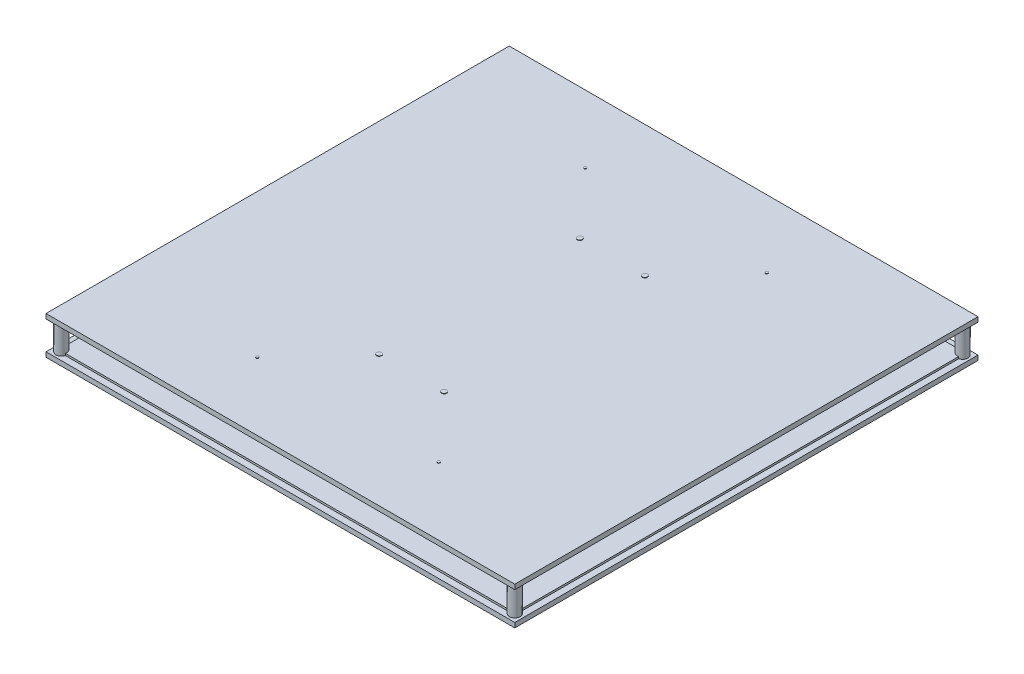
from build123d import *

# Parameters (mm, degrees)
SKETCH1_W           = 310.792155558
SKETCH1_H           = 307.10414309
BOSS_EXTRUDE1_DEPTH = 3.175
SKETCH2_W           = 302.308555558
SKETCH2_H           = 298.62054309
BOSS_EXTRUDE2_DEPTH = 1.27
BOSS_EXTRUDE4_DEPTH = 3.175
SKETCH6_R           = 0.911045746
SKETCH6_R_2         = 1.683740392
BOSS_EXTRUDE7_DEPTH = 0.254
SKETCH7_R           = 3.556
BOSS_EXTRUDE8_DEPTH = 23.876


with BuildPart() as part:
    # Sketch1 → Boss-Extrude1 (new body)
    with BuildSketch(Plane(origin=(0, 0, 0), x_dir=(1, 0, 0), z_dir=(0, 1, 0))):
        Rectangle(SKETCH1_W, SKETCH1_H)
    extrude(amount=BOSS_EXTRUDE1_DEPTH)

    # Sketch2 → Boss-Extrude2 (add)
    with BuildSketch(Plane(origin=(0, 3.175, 0), x_dir=(1, 0, 0), z_dir=(0, 1, 0))):
        Rectangle(SKETCH2_W, SKETCH2_H)
    extrude(amount=BOSS_EXTRUDE2_DEPTH)



with BuildPart() as body_2:
    # 3DSketch1 → Boss-Extrude4 (new body)
    with BuildSketch(Plane(origin=(-155.396077779, 25.1714, -153.552071545), x_dir=(0.7113145904869971, 0, 0.7028737819554204), z_dir=(0, -1, 0))):
        Polygon((0, 0), (215.855450508, 218.447657779), (436.926445365, 0), (221.070994857, -218.447657779), align=None)
    extrude(amount=BOSS_EXTRUDE4_DEPTH)

    # Sketch6 → Boss-Extrude7 (add)
    with BuildSketch(Plane(origin=(0, 25.1714, 0), x_dir=(1, 0, 0), z_dir=(0, 1, 0))):
        with Locations(Location((-60.146077779, -108.71629912, 0), (0, 0, 90))):
            Circle(SKETCH6_R)
        with Locations(Location((-21.538077779, -66.55229912, 0), (0, 0, 90))):
            Circle(SKETCH6_R_2)
        with Locations(Location((-60.146077779, 108.71629912, 0), (0, 0, 90))):
            Circle(SKETCH6_R)
        with Locations(Location((-21.538077779, 66.55229912, 0), (0, 0, 90))):
            Circle(SKETCH6_R_2)
        with Locations(Location((21.538077779, 66.55229912, 0), (0, 0, 90))):
            Circle(SKETCH6_R_2)
        with Locations(Location((60.146077779, 108.71629912, 0), (0, 0, 90))):
            Circle(SKETCH6_R)
        with Locations(Location((21.538077779, -66.55229912, 0), (0, 0, 90))):
            Circle(SKETCH6_R_2)
        with Locations(Location((60.146077779, -108.71629912, 0), (0, 0, 90))):
            Circle(SKETCH6_R)
    extrude(amount=BOSS_EXTRUDE7_DEPTH)


with BuildPart() as part_1:
    add(part.part)

    add(body_2.part)  # Boss-Extrude8 merges body 2
    # Sketch7 → Boss-Extrude8 (add)
    with BuildSketch(Plane.XZ):
        with Locations(Location((-150.316077779, 148.472071545, 0), (0, 0, 270))):
            Circle(SKETCH7_R)
        with Locations(Location((150.316077779, 148.472071545, 0), (0, 0, 270))):
            Circle(SKETCH7_R)
        with Locations(Location((150.316077779, -148.472071545, 0), (0, 0, 270))):
            Circle(SKETCH7_R)
        with Locations(Location((-150.316077779, -148.472071545, 0), (0, 0, 270))):
            Circle(SKETCH7_R)
    extrude(amount=-BOSS_EXTRUDE8_DEPTH)


solid = part_1.part
